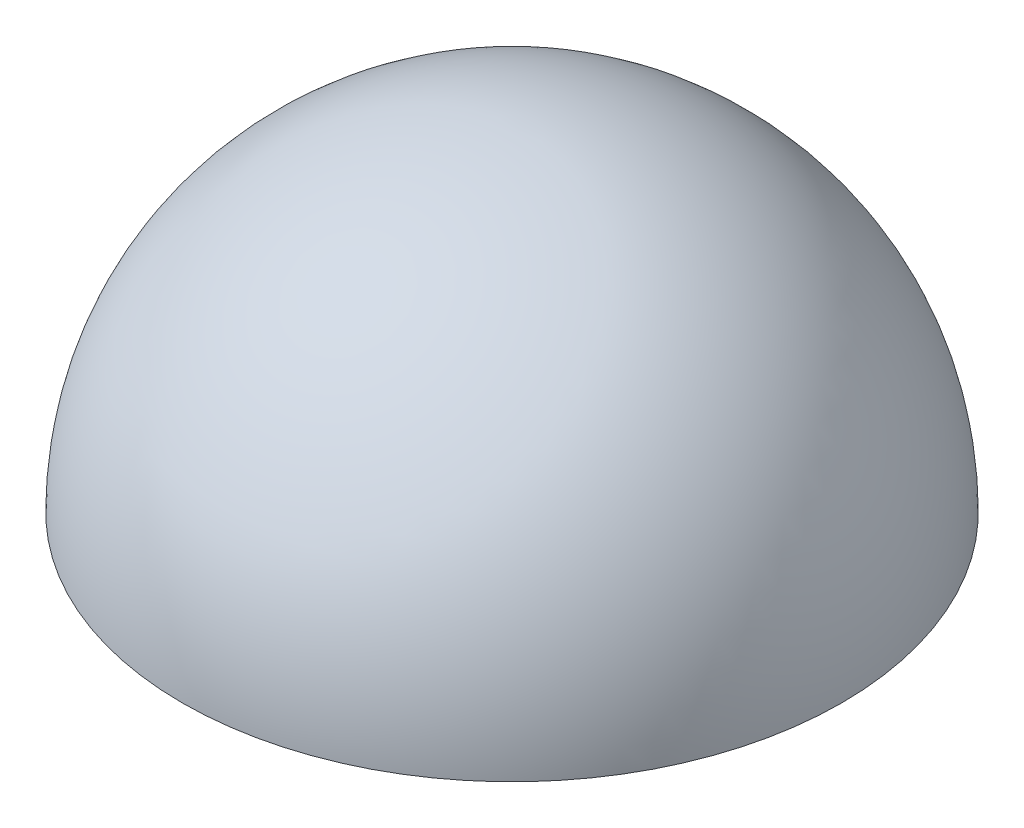
from build123d import *


with BuildPart() as part:
    # Sketch1 → Revolve1 (revolve)
    with BuildSketch(Plane.XY):
        with BuildLine():
            Line((0, 0), (0, 12.7))
            ThreePointArc((0, 12.7), (-8.980256121, 8.980256121), (-12.7, 0))
            Line((-12.7, 0), (0, 0))
        make_face()
    revolve(axis=Axis((0, 0, 0), (0, 1, 0)))


solid = part.part
